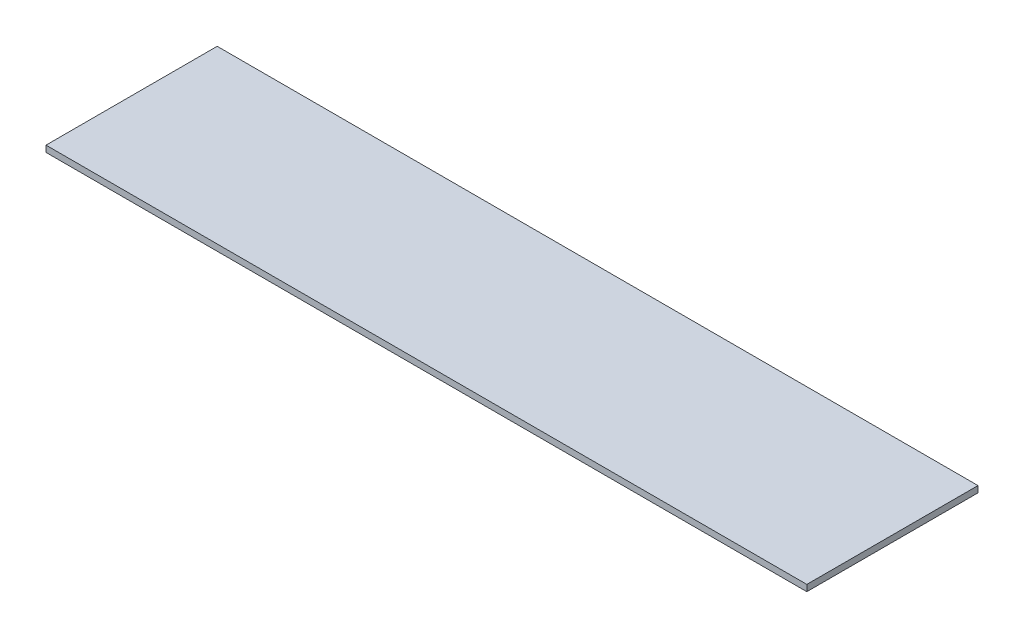
from build123d import *

# Parameters (mm, degrees)
SKETCH1_W           = 120
SKETCH1_H           = 27
BOSS_EXTRUDE1_DEPTH = 1


with BuildPart() as part:
    # Sketch1 → Boss-Extrude1 (new body)
    with BuildSketch(Plane(origin=(0, 0, 0), x_dir=(1, 0, 0), z_dir=(0, 1, 0))):
        with Locations((60, 13.5)):
            Rectangle(SKETCH1_W, SKETCH1_H)
    extrude(amount=BOSS_EXTRUDE1_DEPTH)


solid = part.part
